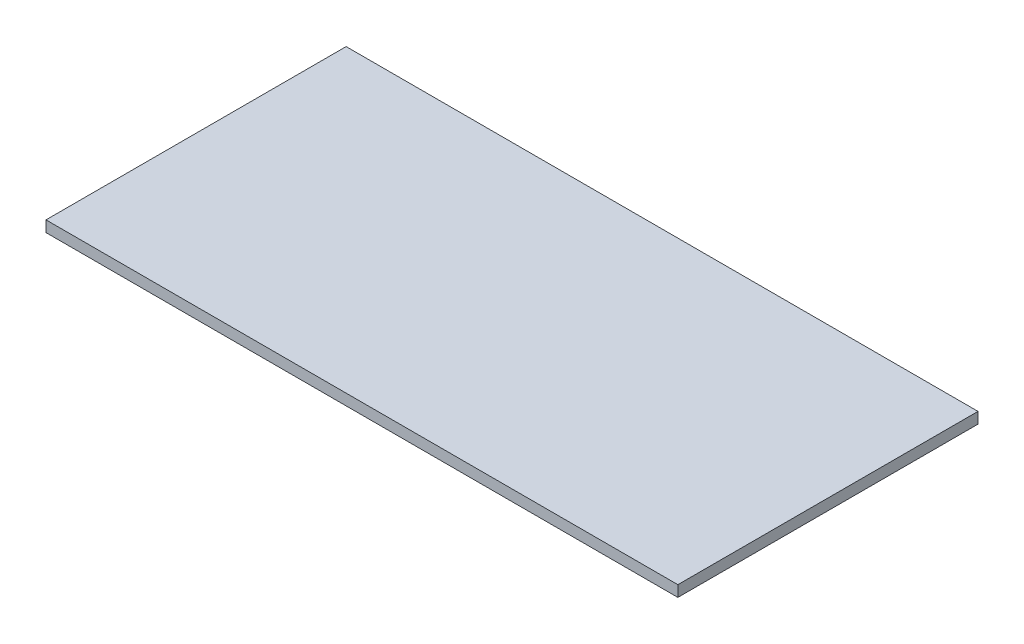
from build123d import *

# Parameters (mm, degrees)
SKETCH_1_W      = 80
SKETCH_1_H      = 38
EXTRUDE_1_DEPTH = 1.4


with BuildPart() as part:
    # 草图1 → 凸台-拉伸1 (new body)
    with BuildSketch(Plane(origin=(0, 0, 0), x_dir=(1, 0, 0), z_dir=(0, 1, 0))):
        with Locations((40, 19)):
            Rectangle(SKETCH_1_W, SKETCH_1_H)
    extrude(amount=EXTRUDE_1_DEPTH)


solid = part.part
